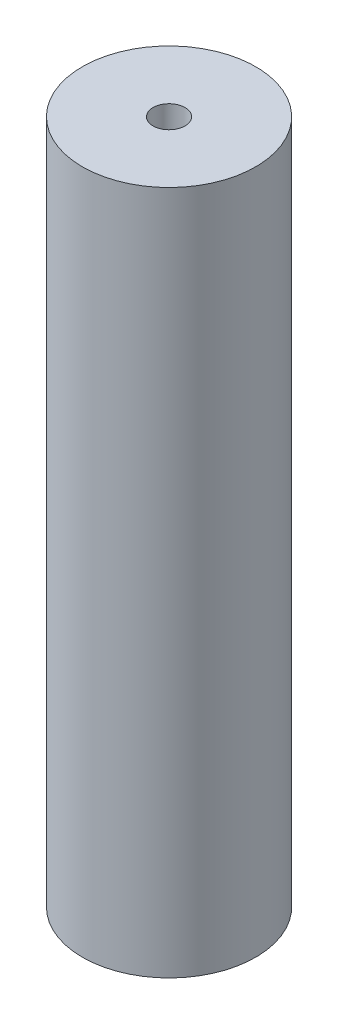
from build123d import *

# Parameters (mm, degrees)
SKETCH1_R           = 19
SKETCH1_R_2         = 3.5
BOSS_EXTRUDE1_DEPTH = 150


with BuildPart() as part:
    # Sketch1 → Boss-Extrude1 (new body)
    with BuildSketch(Plane(origin=(0, 0, 0), x_dir=(1, 0, 0), z_dir=(0, 1, 0))):
        with Locations(Location((0, 0, 0), (0, 0, 270))):
            Circle(SKETCH1_R)
        with Locations(Location((0, 0, 0), (0, 0, 270))):
            Circle(SKETCH1_R_2, mode=Mode.SUBTRACT)
    extrude(amount=BOSS_EXTRUDE1_DEPTH)


solid = part.part
